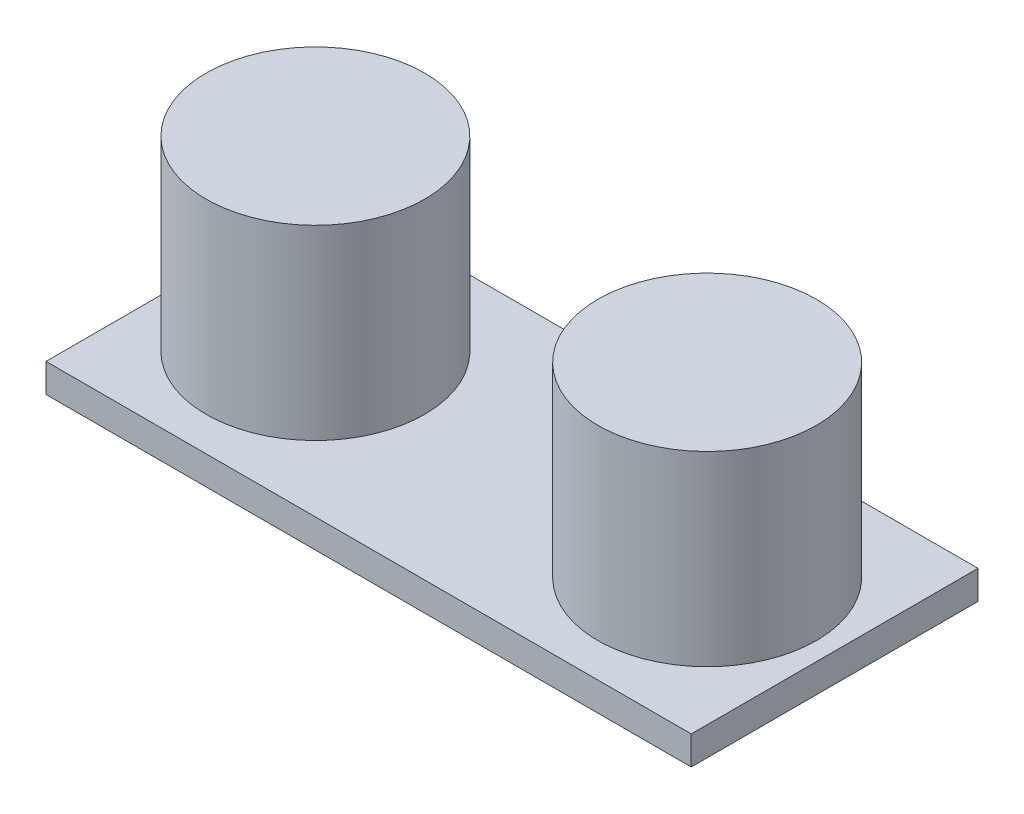
from build123d import *

# Parameters (mm, degrees)
SKETCH1_W           = 45
SKETCH1_H           = 20
BOSS_EXTRUDE1_DEPTH = 2
SKETCH2_R           = 7.62
BOSS_EXTRUDE2_DEPTH = 13


with BuildPart() as part:
    # Sketch1 → Boss-Extrude1 (new body)
    with BuildSketch(Plane(origin=(0, 0, 0), x_dir=(1, 0, 0), z_dir=(0, 1, 0))):
        with Locations((22.5, 10)):
            Rectangle(SKETCH1_W, SKETCH1_H)
    extrude(amount=BOSS_EXTRUDE1_DEPTH)

    # Sketch2 → Boss-Extrude2 (add)
    with BuildSketch(Plane(origin=(0, 2, 0), x_dir=(1, 0, 0), z_dir=(0, 1, 0))):
        with Locations(Location((8.787506648, 10, 0), (0, 0, 90))):
            Circle(SKETCH2_R)
        with Locations(Location((36.11, 10, 0), (0, 0, 90))):
            Circle(SKETCH2_R)
    extrude(amount=BOSS_EXTRUDE2_DEPTH)


solid = part.part
